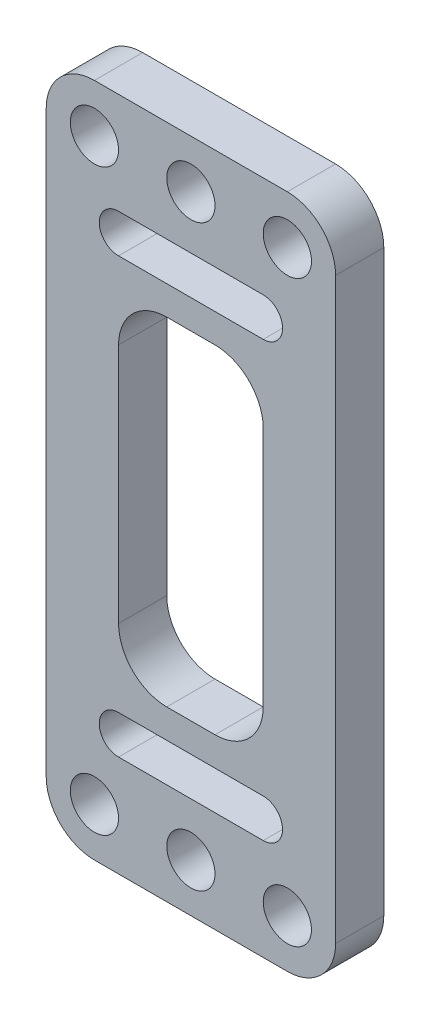
from build123d import *

# Parameters (mm, degrees)
SKETCH1_W           = 30
SKETCH1_H           = 70
SKETCH1_R           = 2.5
BOSS_EXTRUDE1_DEPTH = 5
FILLET1_R           = 5
SKETCH2_W           = 15
SKETCH2_H           = 35
CUT_EXTRUDE1_DEPTH  = 39.405728739
CUT_EXTRUDE2_DEPTH  = 39.405728739
FILLET2_R           = 5


with BuildPart() as part:
    # Sketch1 → Boss-Extrude1 (new body)
    with BuildSketch(Plane.XY):
        Rectangle(SKETCH1_W, SKETCH1_H)
        with Locations((0, 30)):
            Circle(SKETCH1_R, mode=Mode.SUBTRACT)
        with Locations((10, 30)):
            Circle(SKETCH1_R, mode=Mode.SUBTRACT)
        with Locations(Location((-10, 30, 0), (0, 0, 180))):
            Circle(SKETCH1_R, mode=Mode.SUBTRACT)
        with Locations(Location((10, -30, 0), (0, 0, 180))):
            Circle(SKETCH1_R, mode=Mode.SUBTRACT)
        with Locations(Location((0, -30, 0), (0, 0, 180))):
            Circle(SKETCH1_R, mode=Mode.SUBTRACT)
        with Locations((-10, -30)):
            Circle(SKETCH1_R, mode=Mode.SUBTRACT)
    extrude(amount=BOSS_EXTRUDE1_DEPTH)

    # Fillet1
    fillet1_edges = [part.edges().sort_by_distance(p)[0] for p in [
        (15, -35, 2.5),
        (-15, -35, 2.5),
        (-15, 35, 2.5),
        (15, 35, 2.5),
    ]]
    fillet(fillet1_edges, radius=FILLET1_R)

    # Sketch2 → Cut-Extrude1 (cut, through all)
    with BuildSketch(Plane.XY.offset(5)):
        Rectangle(SKETCH2_W, SKETCH2_H)
    extrude(amount=-CUT_EXTRUDE1_DEPTH, mode=Mode.SUBTRACT)

    # Sketch3 → Cut-Extrude2 (cut, through all)
    with BuildSketch(Plane.XY.offset(5)):
        with BuildLine():
            Line((-7.5, 24.5), (7.5, 24.5))
            ThreePointArc((7.5, 24.5), (9.5, 22.5), (7.5, 20.5))
            Line((7.5, 20.5), (-7.5, 20.5))
            ThreePointArc((-7.5, 20.5), (-9.5, 22.5), (-7.5, 24.5))
        make_face()
        with BuildLine():
            Line((-7.5, -24.5), (7.5, -24.5))
            ThreePointArc((7.5, -24.5), (9.5, -22.5), (7.5, -20.5))
            Line((7.5, -20.5), (-7.5, -20.5))
            ThreePointArc((-7.5, -20.5), (-9.5, -22.5), (-7.5, -24.5))
        make_face()
    extrude(amount=-CUT_EXTRUDE2_DEPTH, mode=Mode.SUBTRACT)

    # Fillet2
    fillet2_edges = [part.edges().sort_by_distance(p)[0] for p in [
        (7.5, 17.5, 2.5),
        (7.5, -17.5, 2.5),
        (-7.5, -17.5, 2.5),
        (-7.5, 17.5, 2.5),
    ]]
    fillet(fillet2_edges, radius=FILLET2_R)


solid = part.part
